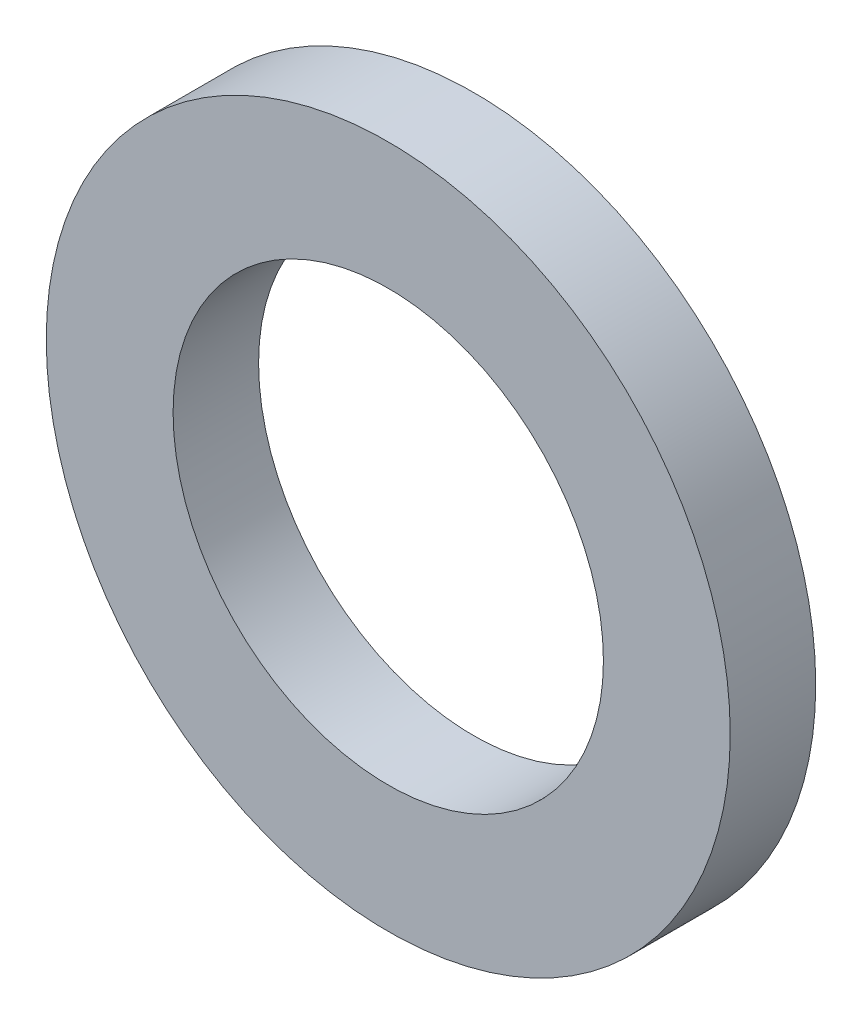
from build123d import *

# Parameters (mm, degrees)
PROFILE_LASER_PROFILE_3MM_R   = 12
PROFILE_LASER_PROFILE_3MM_R_2 = 7.55
LASER_PROFILE_3MM_DEPTH       = 3


with BuildPart() as part:
    # Profile_Laser_profile_3mm → Laser_profile_3mm (new body)
    with BuildSketch(Plane.XY):
        Circle(PROFILE_LASER_PROFILE_3MM_R)
        Circle(PROFILE_LASER_PROFILE_3MM_R_2, mode=Mode.SUBTRACT)
    extrude(amount=LASER_PROFILE_3MM_DEPTH)


solid = part.part
